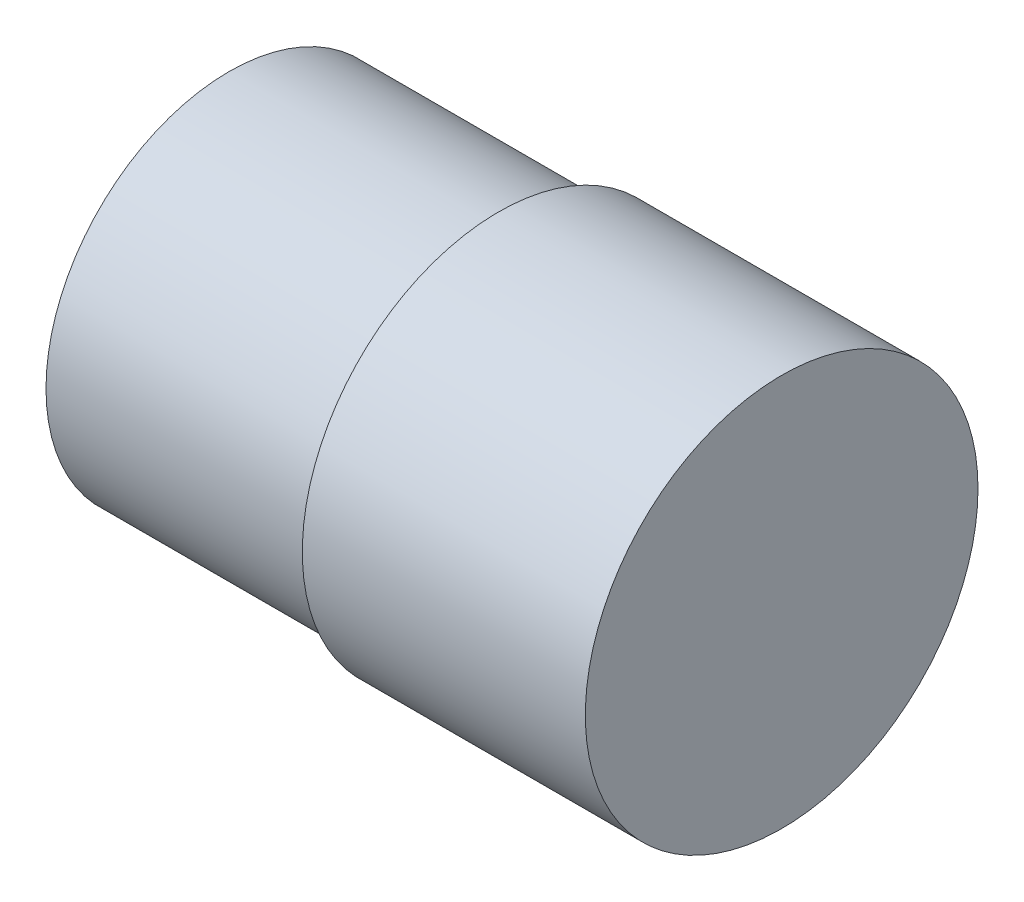
from build123d import *

# Parameters (mm, degrees)
SKETCH1_R           = 18.499999957
BOSS_EXTRUDE1_DEPTH = 26.67
SKETCH2_R           = 17.25
BOSS_EXTRUDE2_DEPTH = 25.4


with BuildPart() as part:
    # Sketch1 → Boss-Extrude1 (new body)
    with BuildSketch(Plane(origin=(0, 0, 0), x_dir=(0, 0, -1), z_dir=(1, 0, 0))):
        Circle(SKETCH1_R)
    extrude(amount=BOSS_EXTRUDE1_DEPTH)

    # Sketch2 → Boss-Extrude2 (add)
    with BuildSketch(Plane.ZY):
        Circle(SKETCH2_R)
    extrude(amount=BOSS_EXTRUDE2_DEPTH)


solid = part.part
